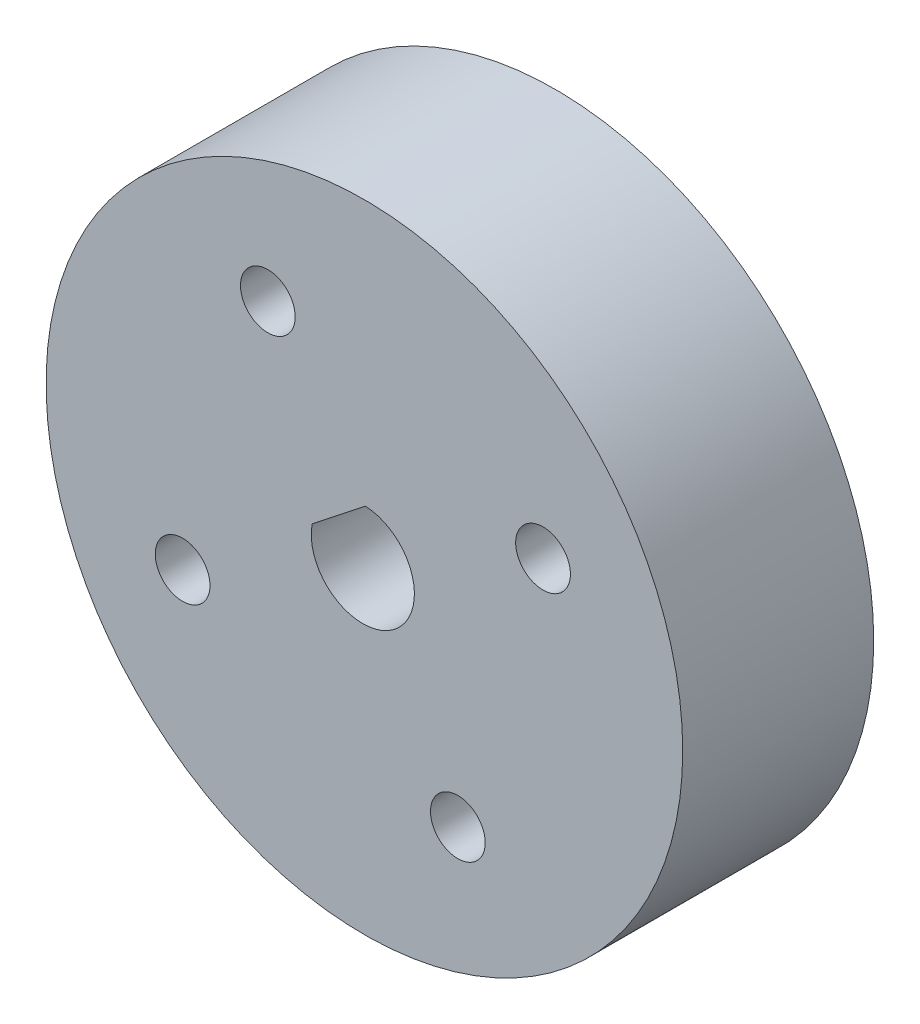
from build123d import *

# Parameters (mm, degrees)
SKETCH_1_R          = 25
EXTRUDE_1_DEPTH     = 15
SKETCH_2_R          = 15.2
CUT_EXTRUDE_1_DEPTH = 8
SKETCH_3_R          = 2.15
CUT_EXTRUDE_2_DEPTH = 10
CUT_EXTRUDE_3_DEPTH = 39.405728739


with BuildPart() as part:
    # 草图1 → 凸台-拉伸1 (new body)
    with BuildSketch(Plane.XY):
        Circle(SKETCH_1_R)
    extrude(amount=EXTRUDE_1_DEPTH)

    # 草图2 → 切除-拉伸1 (cut)
    with BuildSketch(Plane(origin=(0, 0, 0), x_dir=(-1, 0, 0), z_dir=(0, 0, -1))):
        Circle(SKETCH_2_R)
    extrude(amount=-CUT_EXTRUDE_1_DEPTH, mode=Mode.SUBTRACT)

    # 草图3 → 切除-拉伸2 (cut)
    with BuildSketch(Plane.XY.offset(15)):
        with Locations((-14.278039738, -7.313917654)):
            Circle(SKETCH_3_R)
        with Locations((-7.586084988, 14.301302484)):
            Circle(SKETCH_3_R)
        with Locations((14.029135151, 7.609347734)):
            Circle(SKETCH_3_R)
        with Locations((7.3371804, -14.005872405)):
            Circle(SKETCH_3_R)
    extrude(amount=-CUT_EXTRUDE_2_DEPTH, mode=Mode.SUBTRACT)

    # 草图4 → 切除-拉伸3 (cut, through all)
    with BuildSketch(Plane.XY.offset(15)):
        with BuildLine():
            ThreePointArc((3.925547706, 0.14771504), (2.811003713, 2.937983491), (0.080807938, 4.192510243))
            Line((0.080807938, 4.192510243), (-4.105054455, 0.894244634))
            ThreePointArc((-4.105054455, 0.894244634), (-0.499326438, -3.88489818), (3.925547706, 0.14771504))
        make_face()
    extrude(amount=-CUT_EXTRUDE_3_DEPTH, mode=Mode.SUBTRACT)


solid = part.part
